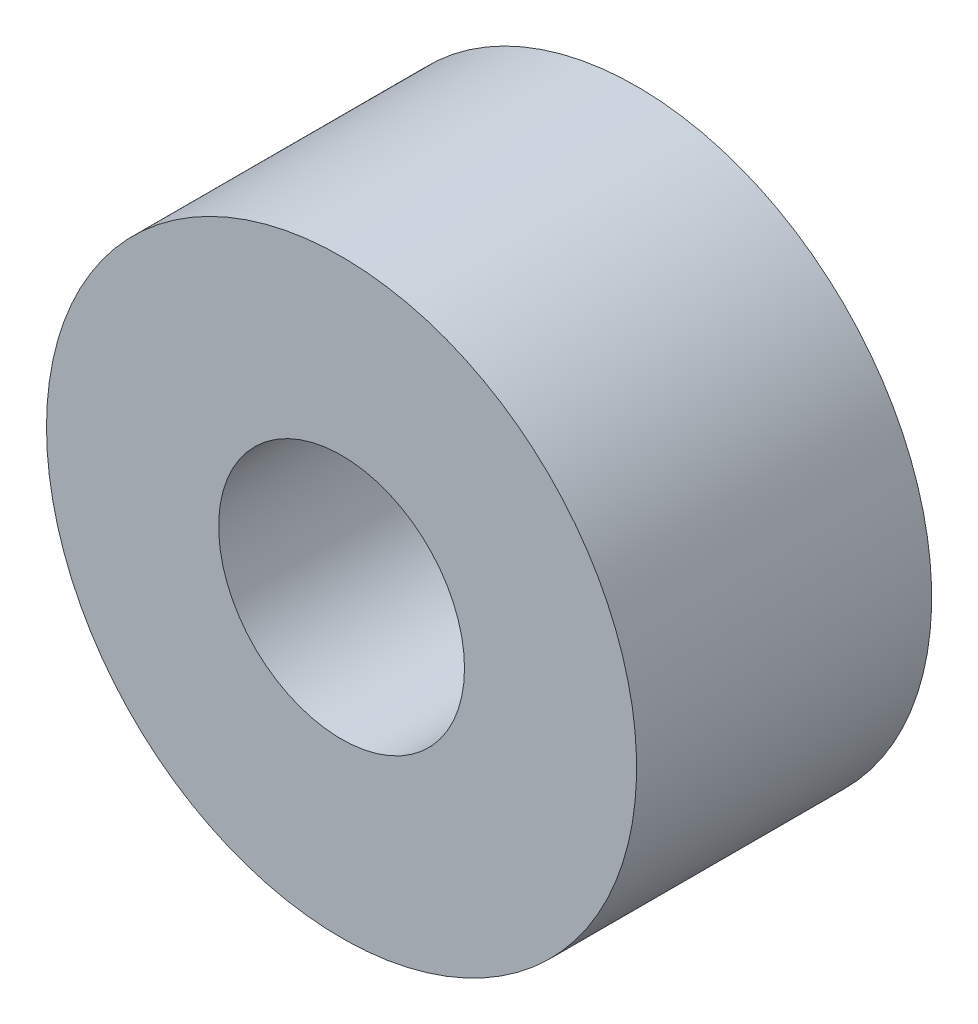
from build123d import *

# Parameters (mm, degrees)
SKETCH1_R           = 19.05
BOSS_EXTRUDE1_DEPTH = 19.05
SKETCH2_R           = 7.9375
CUT_EXTRUDE1_DEPTH  = 33.995567884


with BuildPart() as part:
    # Sketch1 → Boss-Extrude1 (new body)
    with BuildSketch(Plane.XY):
        with Locations(Location((0, 0, 0), (0, 0, 180))):
            Circle(SKETCH1_R)
    extrude(amount=BOSS_EXTRUDE1_DEPTH)

    # Sketch2 → Cut-Extrude1 (cut, through all)
    with BuildSketch(Plane.XY.offset(19.05)):
        Circle(SKETCH2_R)
    extrude(amount=-CUT_EXTRUDE1_DEPTH, mode=Mode.SUBTRACT)


solid = part.part
